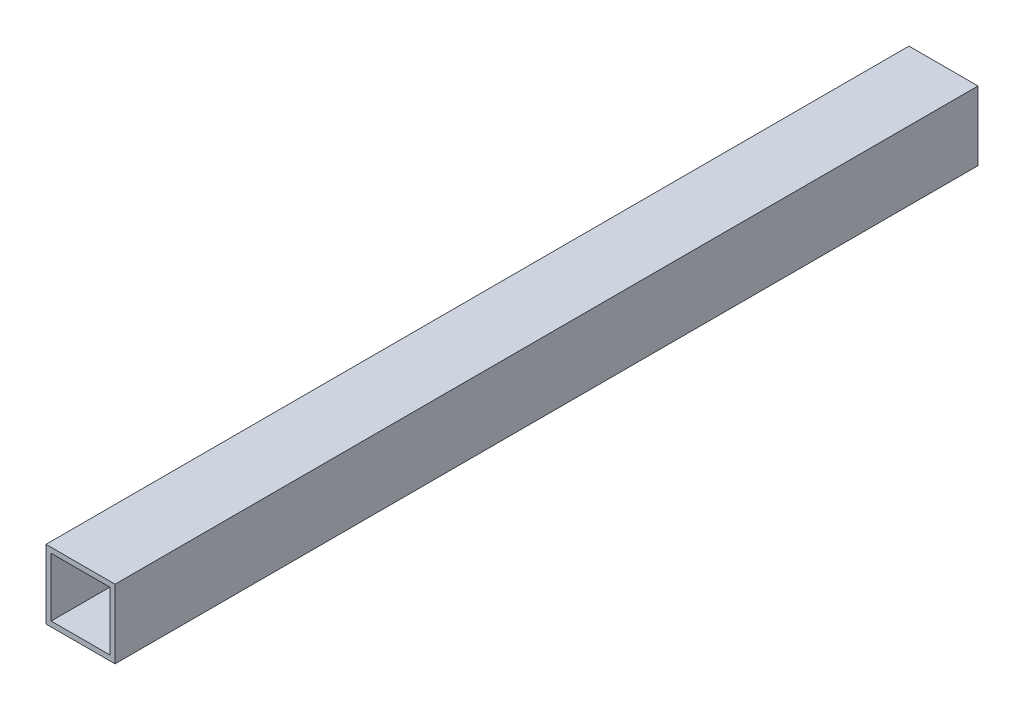
from build123d import *

# Parameters (mm, degrees)
SKETCH_1_W      = 20
SKETCH_1_H      = 20
SKETCH_1_W_2    = 17
SKETCH_1_H_2    = 17
EXTRUDE_1_DEPTH = 250


with BuildPart() as part:
    # ｽｹｯﾁ1 → ﾎﾞｽ - 押し出し1 (new body)
    with BuildSketch(Plane.XY):
        Rectangle(SKETCH_1_W, SKETCH_1_H)
        Rectangle(SKETCH_1_W_2, SKETCH_1_H_2, mode=Mode.SUBTRACT)
    extrude(amount=EXTRUDE_1_DEPTH)


solid = part.part
